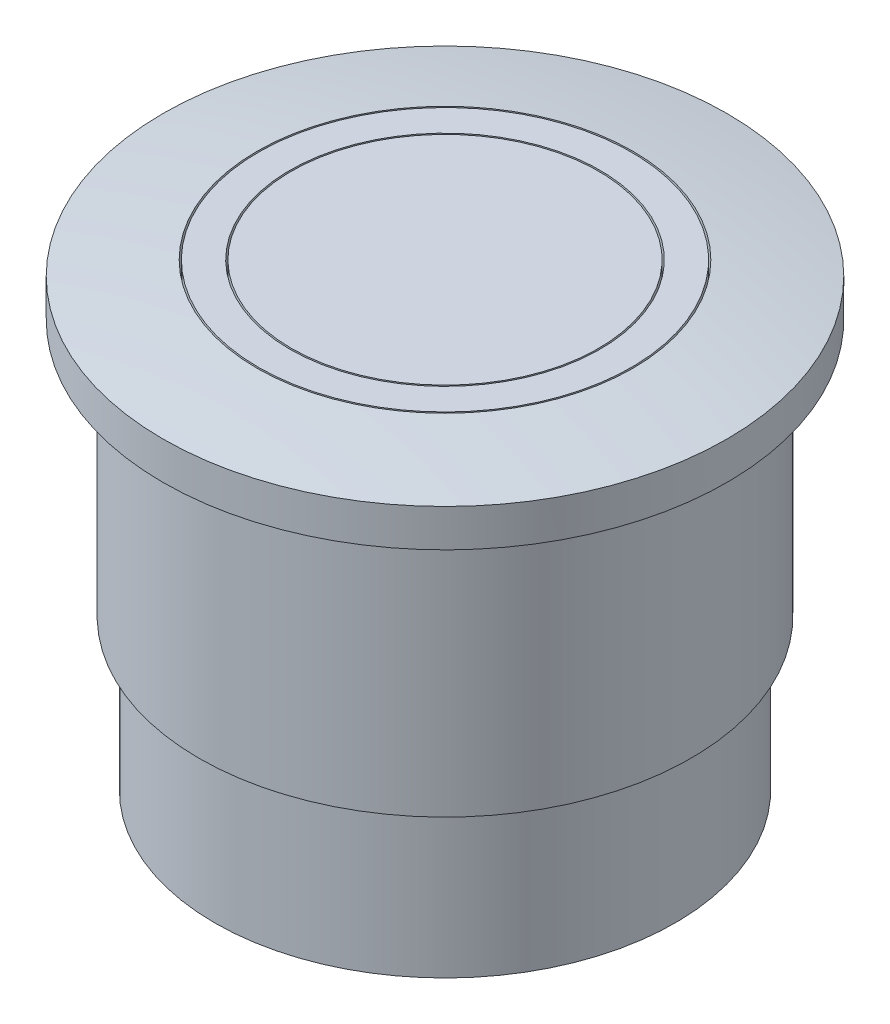
from build123d import *

# Parameters (mm, degrees)
SKETCH1_R           = 7.35
BOSS_EXTRUDE1_DEPTH = 4.8
SKETCH2_R           = 7.85
BOSS_EXTRUDE2_DEPTH = 8.2
SKETCH4_R           = 6
SKETCH4_R_2         = 5.95
SKETCH4_R_3         = 4.95
SKETCH4_R_4         = 4.9
CUT_EXTRUDE1_DEPTH  = 2


with BuildPart() as part:
    # Sketch1 → Boss-Extrude1 (new body)
    with BuildSketch(Plane(origin=(0, 0, 0), x_dir=(1, 0, 0), z_dir=(0, 1, 0))):
        with Locations(Location((0, 0, 0), (0, 0, 270))):
            Circle(SKETCH1_R)
    extrude(amount=BOSS_EXTRUDE1_DEPTH)

    # Sketch2 → Boss-Extrude2 (add)
    with BuildSketch(Plane(origin=(0, 4.8, 0), x_dir=(1, 0, 0), z_dir=(0, 1, 0))):
        with Locations(Location((0, 0, 0), (0, 0, 90))):
            Circle(SKETCH2_R)
    extrude(amount=BOSS_EXTRUDE2_DEPTH)

    # Sketch3 → Revolve2 (revolve)
    with BuildSketch(Plane.XY):
        with BuildLine():
            Line((-9, 13), (-7.85, 13))
            Line((-7.85, 13), (0, 13))
            Line((0, 13), (0, 14.655364075))
            Line((0, 14.655364075), (-6, 14.655364075))
            ThreePointArc((-6, 14.655364075), (-7.503455145, 14.450444998), (-9, 14.2))
            Line((-9, 14.2), (-9, 13))
        make_face()
    revolve(axis=Axis((0, 15.200891001, 0), (0, -1, 0)))

    # Sketch4 → Cut-Extrude1 (cut)
    # profile 1 of 2: a face of its own
    with BuildSketch(Plane(origin=(0, 14.655364075, 0), x_dir=(1, 0, 0), z_dir=(0, 1, 0))):
        with Locations(Location((0, 0, 0), (0, 0, 270))):
            Circle(SKETCH4_R)
        with Locations(Location((0, 0, 0), (0, 0, 270))):
            Circle(SKETCH4_R_2, mode=Mode.SUBTRACT)
    # profile 2 of 2: a face of its own
    with BuildSketch(Plane(origin=(0, 14.655364075, 0), x_dir=(1, 0, 0), z_dir=(0, 1, 0))):
        with Locations(Location((0, 0, 0), (0, 0, 270))):
            Circle(SKETCH4_R_3)
        with Locations(Location((0, 0, 0), (0, 0, 270))):
            Circle(SKETCH4_R_4, mode=Mode.SUBTRACT)
    extrude(amount=-CUT_EXTRUDE1_DEPTH, mode=Mode.SUBTRACT)


solid = part.part
